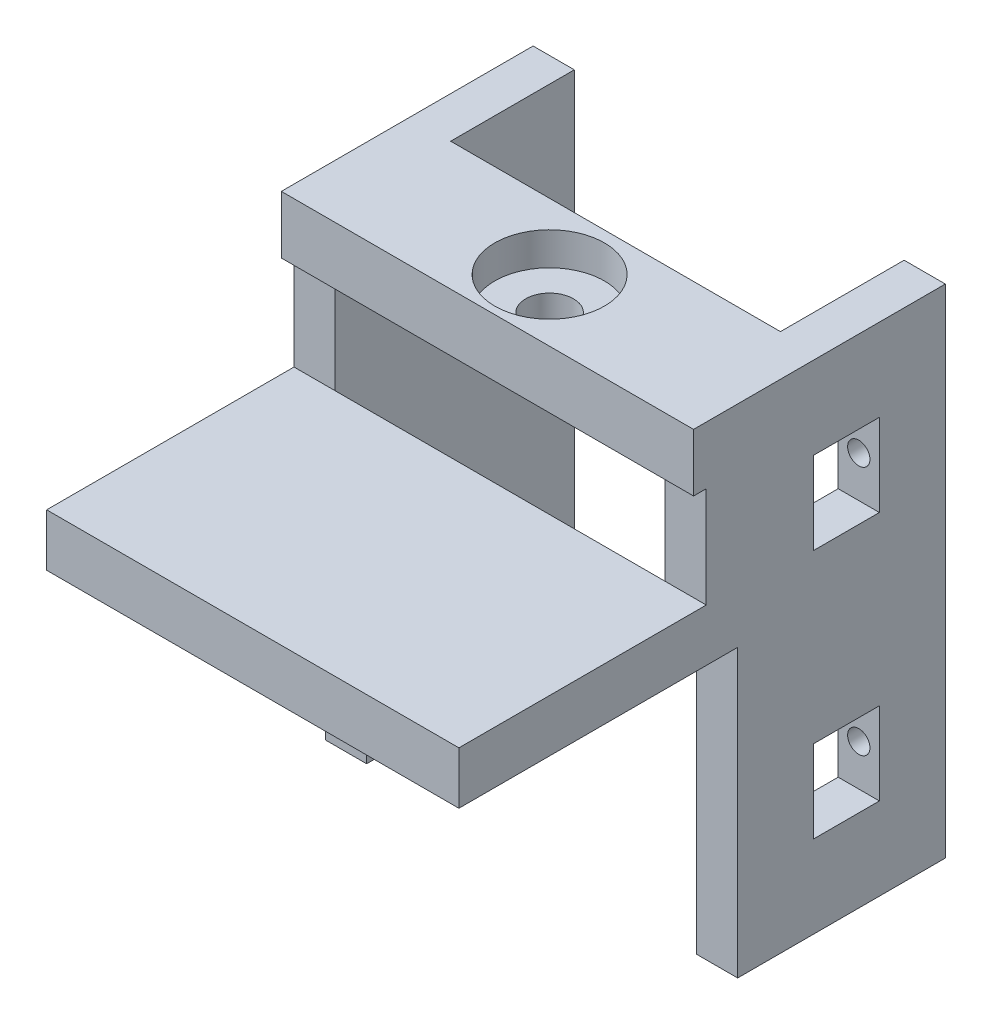
from build123d import *

# Parameters (mm, degrees)
SKETCH1_W                 = 50
SKETCH1_H                 = 30
BOSS_EXTRUDE1_DEPTH       = 7
SKETCH2_W                 = 27
SKETCH2_H                 = 60.3
BOSS_EXTRUDE2_DEPTH       = 5
SKETCH3_W                 = 40
SKETCH3_H                 = 7
BOSS_EXTRUDE3_DEPTH       = 12
SKETCH4_R                 = 6.65
CUT_EXTRUDE1_DEPTH        = 4
CUT_EXTRUDE2_REACH        = 96.439
SKETCH5_R                 = 2.9
SKETCH6_W                 = 8
SKETCH6_H                 = 10
CUT_EXTRUDE3_DEPTH        = 93.681659459
F_2_CLEARANCE_HOLE1_D     = 2.7051
F_2_CLEARANCE_HOLE1_DEPTH = 8
SKETCH10_W                = 50
SKETCH10_H                = 7
BOSS_EXTRUDE4_DEPTH       = 2
SKETCH11_W                = 5
SKETCH11_H                = 53.3
BOSS_EXTRUDE5_DEPTH       = 2
SKETCH13_W                = 5
SKETCH13_H                = 6.35
BOSS_EXTRUDE6_DEPTH       = 30
SKETCH14_W                = 30
SKETCH14_H                = 6.35
BOSS_EXTRUDE7_DEPTH       = 40
SKETCH15_W                = 28.462792601
SKETCH15_H                = 7
CUT_EXTRUDE4_DEPTH        = 93.681659459
SKETCH16_W                = 3.81
SKETCH16_H                = 34.732
CUT_EXTRUDE5_DEPTH        = 93.681659459


with BuildPart() as part:
    # Sketch1 → Boss-Extrude1 (new body)
    with BuildSketch(Plane(origin=(0, 0, 0), x_dir=(1, 0, 0), z_dir=(0, 1, 0))):
        with Locations((25, 15)):
            Rectangle(SKETCH1_W, SKETCH1_H)
    extrude(amount=BOSS_EXTRUDE1_DEPTH)

    # Sketch2 → Boss-Extrude2 (add)
    with BuildSketch(Plane(origin=(50, 0, 0), x_dir=(0, 0, -1), z_dir=(1, 0, 0))):
        with Locations((43.5, -23.15)):
            Rectangle(SKETCH2_W, SKETCH2_H)
    boss_extrude2 = extrude(amount=-BOSS_EXTRUDE2_DEPTH)

    # Mirror1: Boss-Extrude2 across plane
    add(boss_extrude2.mirror(Plane(origin=(25, 0, 0), x_dir=(0, 0, 1), z_dir=(1, 0, 0))))

    # Sketch3 → Boss-Extrude3 (add)
    with BuildSketch(Plane(origin=(0, 0, -30), x_dir=(-1, 0, 0), z_dir=(0, 0, -1))):
        with Locations((-25, 3.5)):
            Rectangle(SKETCH3_W, SKETCH3_H)
    extrude(amount=BOSS_EXTRUDE3_DEPTH)

    # Sketch4 → Cut-Extrude1 (cut)
    with BuildSketch(Plane(origin=(0, 7, 0), x_dir=(1, 0, 0), z_dir=(0, 1, 0))):
        with Locations(Location((25, 34, 0), (0, 0, 270))):
            Circle(SKETCH4_R)
    extrude(amount=-CUT_EXTRUDE1_DEPTH, mode=Mode.SUBTRACT)

    # Sketch5 → Cut-Extrude2 (cut, up to next)
    with BuildSketch(Plane(origin=(0, 3, 0), x_dir=(1, 0, 0), z_dir=(0, 1, 0)), mode=Mode.PRIVATE) as cut_extrude2_sk1:
        with Locations(Location((25, 34, 0), (0, 0, 270))):
            Circle(SKETCH5_R)
    cut_extrude2_tool1 = extrude(cut_extrude2_sk1.sketch, amount=-CUT_EXTRUDE2_REACH, mode=Mode.PRIVATE) & part.part
    add(cut_extrude2_tool1.solids().sort_by_distance((25, 3, -34))[0], mode=Mode.SUBTRACT)

    # Sketch6 → Cut-Extrude3 (cut, through all)
    with BuildSketch(Plane(origin=(50, 0, 0), x_dir=(0, 0, -1), z_dir=(1, 0, 0))):
        with Locations((45, -8)):
            Rectangle(SKETCH6_W, SKETCH6_H)
        with Locations((45, -38.3)):
            Rectangle(SKETCH6_W, SKETCH6_H)
    extrude(amount=-CUT_EXTRUDE3_DEPTH, mode=Mode.SUBTRACT)

    # #2 Clearance Hole1
    with Locations(Plane.XY.offset(-49)):
        with Locations((47.5, -38.3), (47.5, -8), (2.5, -8), (2.5, -38.3)):
            Hole(F_2_CLEARANCE_HOLE1_D / 2, depth=F_2_CLEARANCE_HOLE1_DEPTH)

    # Sketch10 → Boss-Extrude4 (add)
    with BuildSketch(Plane.XY):
        with Locations((25, 3.5)):
            Rectangle(SKETCH10_W, SKETCH10_H)
    extrude(amount=BOSS_EXTRUDE4_DEPTH)

    # Sketch11 → Boss-Extrude5 (add)
    with BuildSketch(Plane.XY.offset(-30)):
        with Locations((47.5, -26.65)):
            Rectangle(SKETCH11_W, SKETCH11_H)
        with Locations((2.5, -26.65)):
            Rectangle(SKETCH11_W, SKETCH11_H)
    extrude(amount=BOSS_EXTRUDE5_DEPTH)

    # Sketch13 → Boss-Extrude6 (add)
    with BuildSketch(Plane.XY.offset(-28)):
        with Locations((47.5, -15.393)):
            Rectangle(SKETCH13_W, SKETCH13_H)
        with Locations((2.5, -15.393)):
            Rectangle(SKETCH13_W, SKETCH13_H)
    extrude(amount=BOSS_EXTRUDE6_DEPTH)

    # Sketch14 → Boss-Extrude7 (add)
    with BuildSketch(Plane.ZY.offset(-45)):
        with Locations((-13, -15.393)):
            Rectangle(SKETCH14_W, SKETCH14_H)
    extrude(amount=BOSS_EXTRUDE7_DEPTH)

    # Sketch15 → Cut-Extrude4 (cut, through all)
    with BuildSketch(Plane(origin=(50, 0, 0), x_dir=(0, 0, -1), z_dir=(1, 0, 0))):
        with Locations((12.231396301, 3.5)):
            Rectangle(SKETCH15_W, SKETCH15_H)
    extrude(amount=-CUT_EXTRUDE4_DEPTH, mode=Mode.SUBTRACT)

    # Sketch16 → Cut-Extrude5 (cut, through all)
    with BuildSketch(Plane(origin=(50, 0, 0), x_dir=(0, 0, -1), z_dir=(1, 0, 0))):
        with Locations((29.905, -35.934)):
            Rectangle(SKETCH16_W, SKETCH16_H)
    extrude(amount=-CUT_EXTRUDE5_DEPTH, mode=Mode.SUBTRACT)


solid = part.part
